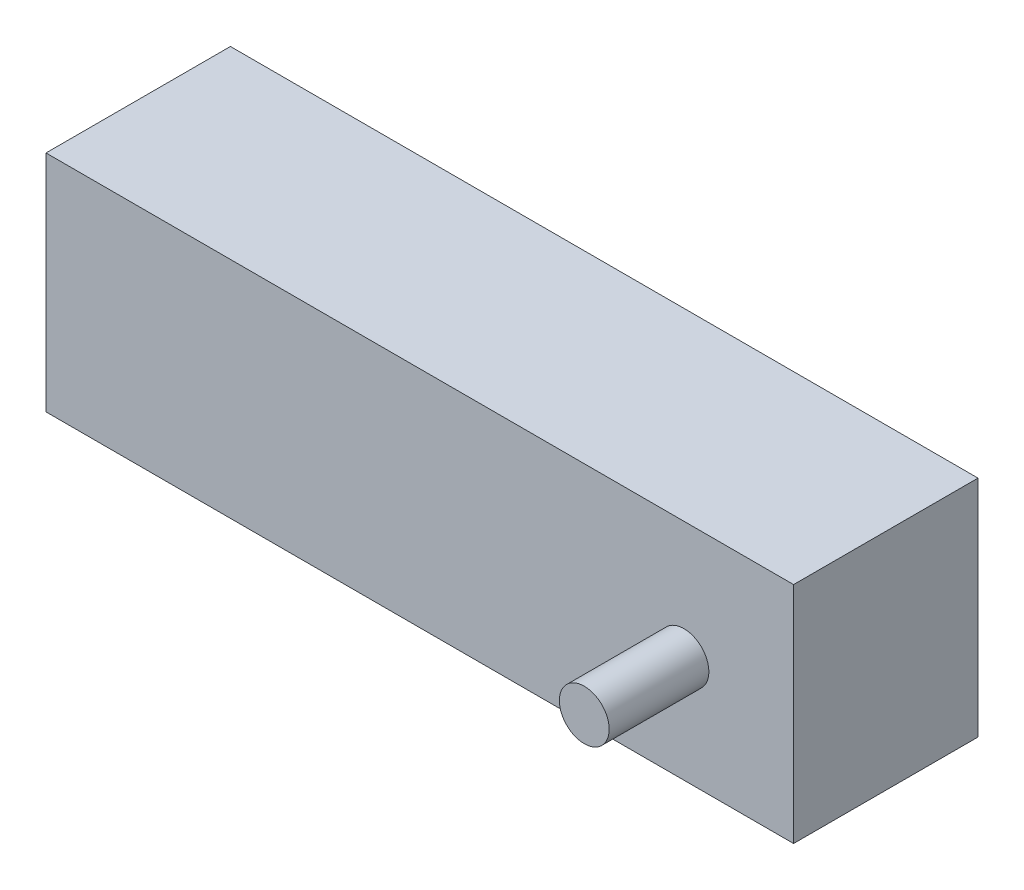
from build123d import *

# Parameters (mm, degrees)
SKETCH1_W           = 75
SKETCH1_H           = 22.5
BOSS_EXTRUDE1_DEPTH = 18.5
SKETCH2_R           = 2.5
BOSS_EXTRUDE2_DEPTH = 10
SKETCH3_R           = 1.5
CUT_EXTRUDE1_DEPTH  = 15


with BuildPart() as part:
    # Sketch1 → Boss-Extrude1 (new body)
    with BuildSketch(Plane.XY):
        with Locations((40, -1.859504132)):
            Rectangle(SKETCH1_W, SKETCH1_H)
    extrude(amount=BOSS_EXTRUDE1_DEPTH)

    # Sketch2 → Boss-Extrude2 (add)
    with BuildSketch(Plane.XY.offset(18.5)):
        with Locations(Location((66.5, -2.437272613, 0), (0, 0, 180))):
            Circle(SKETCH2_R)
    extrude(amount=BOSS_EXTRUDE2_DEPTH)

    # Sketch3 → Cut-Extrude1 (cut)
    with BuildSketch(Plane(origin=(0, 0, 0), x_dir=(-1, 0, 0), z_dir=(0, 0, -1))):
        with Locations((-46, 7.390495868)):
            Circle(SKETCH3_R)
        with Locations((-46, -11.109504132)):
            Circle(SKETCH3_R)
    extrude(amount=-CUT_EXTRUDE1_DEPTH, mode=Mode.SUBTRACT)


solid = part.part
